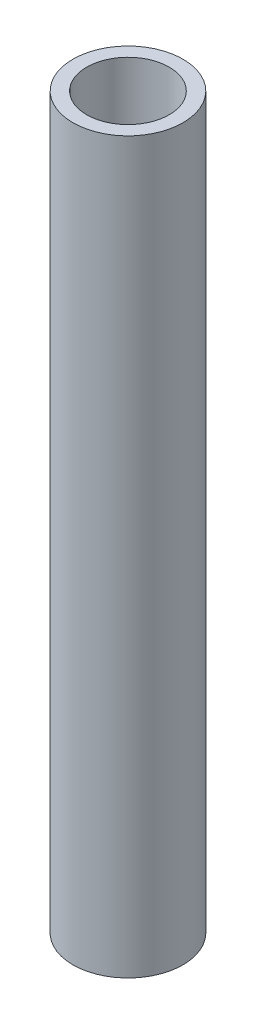
from build123d import *

# Parameters (mm, degrees)
BOSS_EXTRUDE1_DEPTH      = 13.25
BOSS_EXTRUDE1_DEPTH_BACK = 13.25
SKETCH1_R                = 2
SKETCH1_R_2              = 1.5


with BuildPart() as part:
    # Sketch1 → Boss-Extrude1 (new, two sides: drawn at the far end of the back side and taken through both)
    with BuildSketch(Plane(origin=(0, 0, 0), x_dir=(1, 0, 0), z_dir=(0, 1, 0)).offset(-BOSS_EXTRUDE1_DEPTH_BACK)):
        Circle(SKETCH1_R)
        Circle(SKETCH1_R_2, mode=Mode.SUBTRACT)
    extrude(amount=BOSS_EXTRUDE1_DEPTH + BOSS_EXTRUDE1_DEPTH_BACK)


solid = part.part
